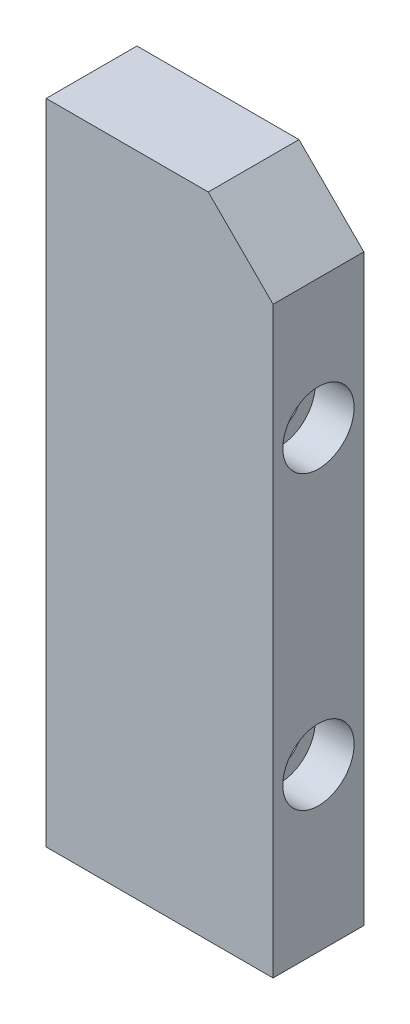
from build123d import *

# Parameters (mm, degrees)
SZKIC1_W                                             = 35
SZKIC1_H                                             = 100
DODANIE_WYCI_GNI_CIE1_DEPTH                          = 14
SFAZOWANIE1_SIZE                                     = 10
POG_BIENIE_WALCOWE_POD_M6_WKR_T_DO_CZ_CI_D           = 6.5
POG_BIENIE_WALCOWE_POD_M6_WKR_T_DO_CZ_CI_CBORE_D     = 11
POG_BIENIE_WALCOWE_POD_M6_WKR_T_DO_CZ_CI_CBORE_DEPTH = 6
OTW_R_GWINTOWANY_M6X1_01_D                           = 5
OTW_R_GWINTOWANY_M6X1_01_DEPTH                       = 17
OTW_R_GWINTOWANY_M6X1_01_TIP                         = 1.502151548


with BuildPart() as part:
    # Szkic1 → Dodanie-wyciągnięcie1 (new body)
    with BuildSketch(Plane.XY):
        with Locations((17.5, 50)):
            Rectangle(SZKIC1_W, SZKIC1_H)
    extrude(amount=DODANIE_WYCI_GNI_CIE1_DEPTH)

    # Sfazowanie1
    sfazowanie1_edges = [part.edges().sort_by_distance(p)[0] for p in [
        (35, 100, 7),
    ]]
    chamfer(sfazowanie1_edges, length=SFAZOWANIE1_SIZE)

    # Pogłębienie walcowe pod M6 Wkręt do części metalowych z łbem sześciokątnym1 (through all)
    with Locations(Plane(origin=(35, 0, 0), x_dir=(0, 0, -1), z_dir=(1, 0, 0))):
        with Locations((-7, 70), (-7, 25)):
            CounterBoreHole(POG_BIENIE_WALCOWE_POD_M6_WKR_T_DO_CZ_CI_D / 2, POG_BIENIE_WALCOWE_POD_M6_WKR_T_DO_CZ_CI_CBORE_D / 2, POG_BIENIE_WALCOWE_POD_M6_WKR_T_DO_CZ_CI_CBORE_DEPTH)

    # Otwór gwintowany M6x1.01
    with Locations(Plane(origin=(0, 0, 0), x_dir=(-1, 0, 0), z_dir=(0, -1, 0))):
        with Locations((-17.5, -7)):
            Hole(OTW_R_GWINTOWANY_M6X1_01_D / 2, depth=OTW_R_GWINTOWANY_M6X1_01_DEPTH)
            with Locations((0, 0, -(OTW_R_GWINTOWANY_M6X1_01_DEPTH + OTW_R_GWINTOWANY_M6X1_01_TIP / 2))):  # 118° drill point
                Cone(0, OTW_R_GWINTOWANY_M6X1_01_D / 2, OTW_R_GWINTOWANY_M6X1_01_TIP, mode=Mode.SUBTRACT)


solid = part.part
